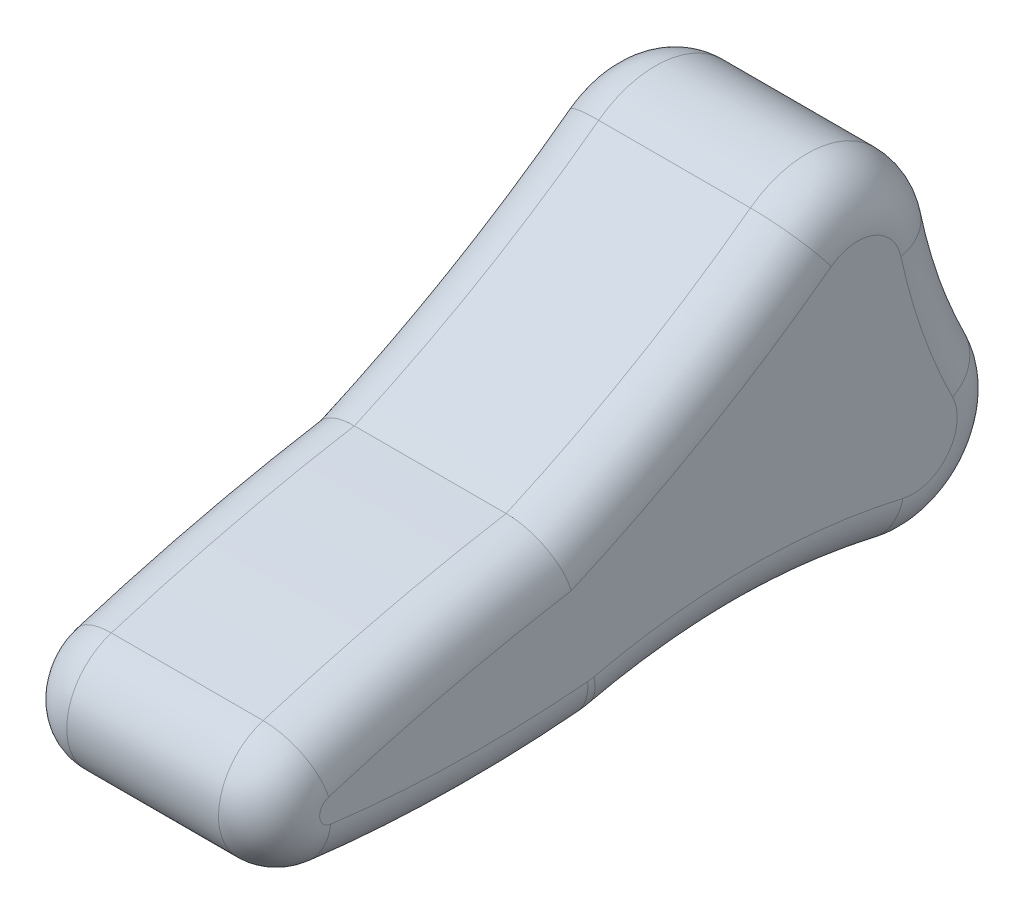
from build123d import *

# Parameters (mm, degrees)
BASE_EXTRUDE_DEPTH  = 50.8
BOSS_EXTRUDE1_DEPTH = 50.8
FILLET1_R           = 20.32


with BuildPart() as part:
    # Sketch11 → Base-Extrude (new, symmetric)
    with BuildSketch(Plane(origin=(114.3, 0, 0), x_dir=(0, 0, -1), z_dir=(1, 0, 0))):
        with BuildLine():
            ThreePointArc((63.178221596, -1151.070511061), (39.347988394, -1123.361347139), (3.158238478, -1128.458383606))
            ThreePointArc((3.158238478, -1128.458383606), (-46.274692445, -1160.977570565), (-99.153599923, -1187.528151048))
            ThreePointArc((-99.153599923, -1187.528151048), (-120.263310126, -1234.415407855), (-75.44784558, -1259.626692099))
            ThreePointArc((-75.44784558, -1259.626692099), (-17.970029558, -1253.037889633), (39.507786465, -1259.626692099))
            ThreePointArc((39.507786465, -1259.626692099), (78.039277605, -1246.116129882), (82.218579229, -1205.49908249))
            ThreePointArc((82.218579229, -1205.49908249), (70.97536466, -1178.887554042), (63.178221596, -1151.070511061))
        make_face()
    extrude(amount=BASE_EXTRUDE_DEPTH, both=True)

    # Sketch12 → Boss-Extrude1 (add, symmetric)
    with BuildSketch(Plane(origin=(114.3, 0, 0), x_dir=(0, 0, -1), z_dir=(1, 0, 0))):
        with BuildLine():
            ThreePointArc((-80.767718153, -1260.471673516), (-46.262227447, -1217.801332141), (-90.188533351, -1184.909591969))
            ThreePointArc((-90.188533351, -1184.909591969), (-141.808855301, -1195.150236783), (-192.599237233, -1208.929407573))
            ThreePointArc((-192.599237233, -1208.929407573), (-210.409971106, -1235.407951616), (-188.280650243, -1258.399878325))
            ThreePointArc((-188.280650243, -1258.399878325), (-134.579158007, -1262.288565342), (-80.767718153, -1260.471673516))
        make_face()
    extrude(amount=BOSS_EXTRUDE1_DEPTH, both=True)

    # Fillet1
    fillet1_edges = [part.edges().sort_by_distance(p)[0] for p in [
        (63.5, -1178.887554042, -70.97536466),
        (165.1, -1178.887554042, -70.97536466),
        (63.5, -1246.116129882, -78.039277605),
        (63.5, -1123.361347139, -39.347988394),
        (63.5, -1159.833069266, 44.30259242),
        (63.5, -1195.707854694, 144.169405309),
        (63.5, -1235.407951616, 210.409971106),
        (63.5, -1262.288565342, 134.579158007),
        (63.5, -1260.1433157, 78.092830278),
        (63.5, -1253.037889633, 17.970029558),
        (165.1, -1123.361347139, -39.347988394),
        (165.1, -1246.116129882, -78.039277605),
        (165.1, -1159.833069266, 44.30259242),
        (165.1, -1195.707854694, 144.169405309),
        (165.1, -1235.407951616, 210.409971106),
        (165.1, -1262.288565342, 134.579158007),
        (165.1, -1260.1433157, 78.092830278),
        (165.1, -1253.037889633, 17.970029558),
    ]]
    fillet(fillet1_edges, radius=FILLET1_R)


solid = part.part
